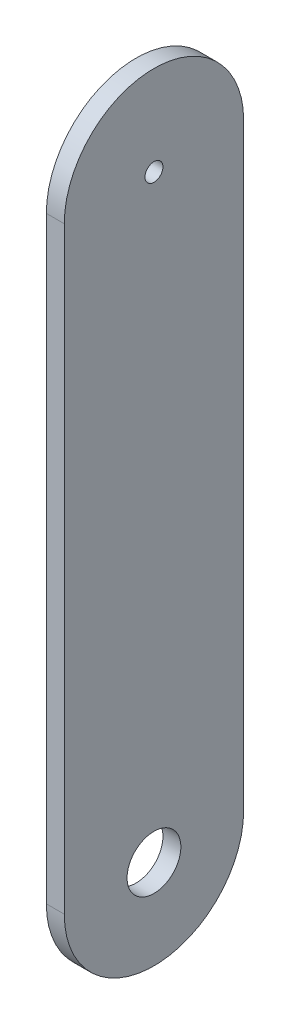
from build123d import *

# Parameters (mm, degrees)
SKETCH1_R           = 4.5
BOSS_EXTRUDE1_DEPTH = 3
SKETCH3_R           = 1.5
CUT_EXTRUDE1_DEPTH  = 10


with BuildPart() as part:
    # Sketch1 → Boss-Extrude1 (new body)
    with BuildSketch(Plane(origin=(0, 0, 0), x_dir=(0, 0, -1), z_dir=(1, 0, 0))):
        with BuildLine():
            Line((0.169822647, 50), (0.169822647, -50))
            ThreePointArc((0.169822647, -50), (-14.830177353, -65), (-29.830177353, -50))
            Line((-29.830177353, -50), (-29.830177353, 50))
            ThreePointArc((-29.830177353, 50), (-14.830177353, 65), (0.169822647, 50))
        make_face()
        with Locations((-14.830177353, -50)):
            Circle(SKETCH1_R, mode=Mode.SUBTRACT)
    extrude(amount=BOSS_EXTRUDE1_DEPTH)

    # Sketch3 → Cut-Extrude1 (cut)
    with BuildSketch(Plane(origin=(3, 0, 0), x_dir=(0, 0, -1), z_dir=(1, 0, 0))):
        with Locations((-14.830177353, 50)):
            Circle(SKETCH3_R)
    extrude(amount=-CUT_EXTRUDE1_DEPTH, mode=Mode.SUBTRACT)


solid = part.part
